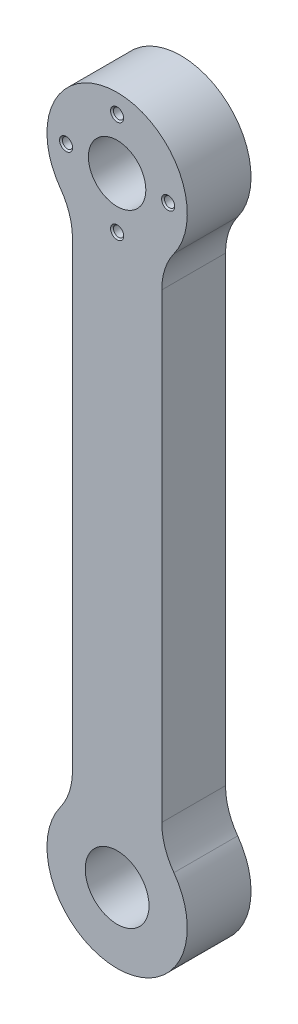
from build123d import *

# Parameters (mm, degrees)
ESQUISSE1_R                 = 4.502635458
BOSS_EXTRU_1_DEPTH          = 10
TROU_TARAUD_M22_D           = 1.6
TROU_TARAUD_M22_CSINK_D     = 2.05
TROU_TARAUD_M22_CSINK_ANGLE = 90
CONG_1_R                    = 10
ESQUISSE9_R                 = 5
ENL_V_MAT_EXTRU_1_DEPTH     = 10


with BuildPart() as part:
    # Esquisse1 → Boss.-Extru.1 (new body)
    with BuildSketch(Plane.XY):
        with BuildLine():
            Line((-7, 40), (-7, -40))
            ThreePointArc((-7, -40), (0, -59.485281374), (7, -40))
            Line((7, -40), (7, 40))
            ThreePointArc((7, 40), (0, 59.485281374), (-7, 40))
        make_face()
        with Locations((0, 48.485281374)):
            Circle(ESQUISSE1_R, mode=Mode.SUBTRACT)
    extrude(amount=BOSS_EXTRU_1_DEPTH)

    # Trou taraudé M22 (through all)
    with Locations(Plane.XY.offset(10)):
        with Locations((-8, 48.485281374), (0, 56.485281374), (8, 48.485281374), (0, 40.485281374)):
            CounterSinkHole(TROU_TARAUD_M22_D / 2, TROU_TARAUD_M22_CSINK_D / 2, counter_sink_angle=TROU_TARAUD_M22_CSINK_ANGLE)

    # Congé1
    cong_1_edges = [part.edges().sort_by_distance(p)[0] for p in [
        (7, 40, 5),
        (7, -40, 5),
        (-7, -40, 5),
        (-7, 40, 5),
    ]]
    fillet(cong_1_edges, radius=CONG_1_R)

    # Esquisse9 → Enlèv. mat.-Extru.1 (cut)
    with BuildSketch(Plane.XY.offset(10)):
        with Locations((0, -48.485281374)):
            Circle(ESQUISSE9_R)
    extrude(amount=-ENL_V_MAT_EXTRU_1_DEPTH, mode=Mode.SUBTRACT)


solid = part.part
